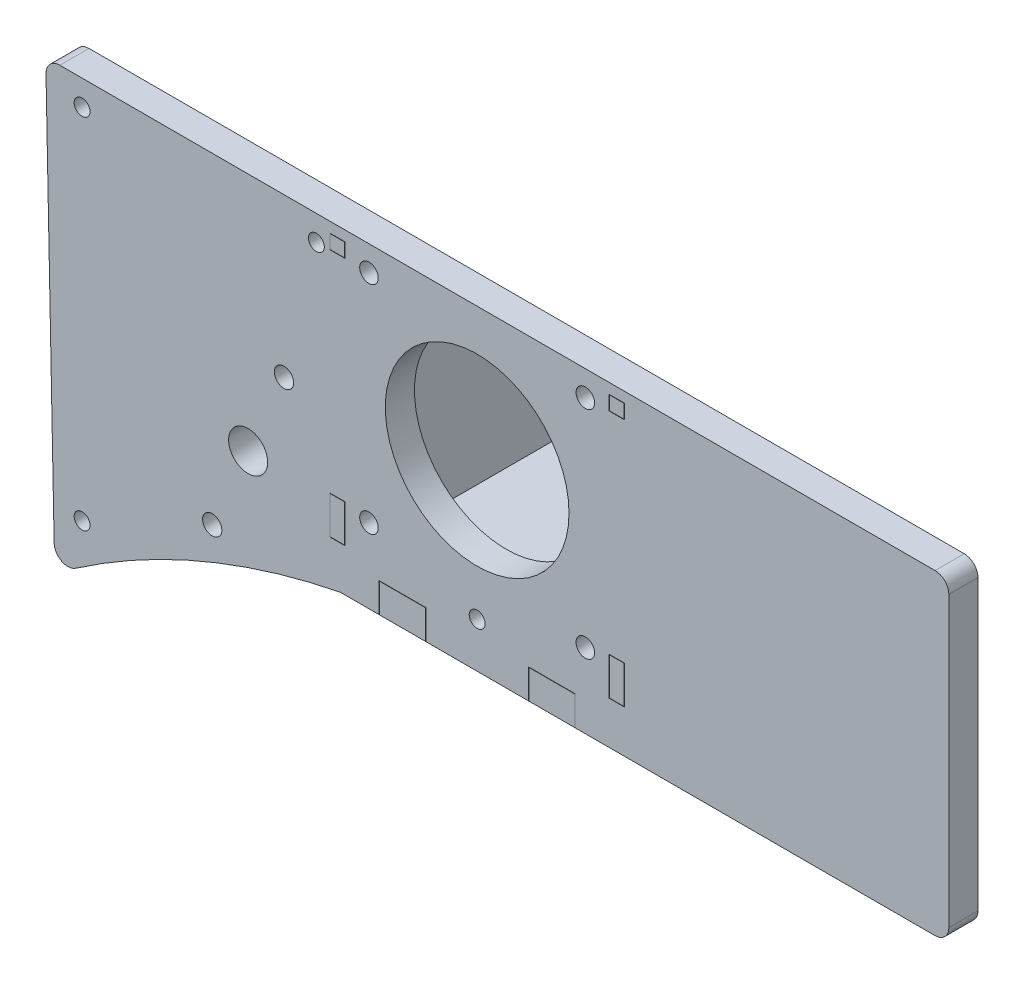
from build123d import *

# Parameters (mm, degrees)
SKETCH1_R              = 4.248828393
SKETCH1_R_2            = 6
SKETCH1_R_3            = 2.0195
EXTRUDE_10_32_DEPTH    = 6.35
SKETCH2_R              = 20
CUT_EXTRUDE1_DEPTH     = 6.35
SKETCH4_R              = 2.1
CUT_EXTRUDE_M5_DEPTH   = 6.35
FILLET2_R              = 3
SKETCH5_R              = 1.727
CUT_EXTRUDE_8_32_DEPTH = 10
BOSS_EXTRUDE1_DEPTH    = 6.35
SKETCH7_W              = 90
SKETCH7_H              = 6.35
BOSS_EXTRUDE2_DEPTH    = 56.175
CUT_EXTRUDE2_DEPTH     = 10
BOSS_EXTRUDE3_START    = 32
BOSS_EXTRUDE3_DEPTH    = 3.175
BOSS_EXTRUDE4_START    = -32
BOSS_EXTRUDE4_DEPTH    = 3.175
SKETCH12_W             = 10.027893718
SKETCH12_H             = 6.35
BOSS_EXTRUDE5_DEPTH    = 6.35
SKETCH13_W             = 3.315
SKETCH13_H             = 3.14
SKETCH13_H_2           = 8.293378994
SKETCH13_W_2           = 10.167893718
SKETCH13_H_3           = 6.49
CUT_EXTRUDE5_DEPTH     = 23.175
SKETCH15_W             = 3.315
SKETCH15_H             = 8.293378994
CUT_EXTRUDE6_DEPTH     = 95.175
FILLET3_R              = 3
FILLET4_R              = 6


with BuildPart() as part:
    # Sketch1 → 10-32 (new body)
    with BuildSketch(Plane.XY):
        with BuildLine():
            Line((-93.919580751, 29.026286008), (-91.967901368, -67.352834202))
            ThreePointArc((-91.967901368, -67.352834202), (-32.48927974, -40.356968754), (32.829000641, -40.430657228))
            Line((32.829000641, -40.430657228), (32.829000641, 26.026286008))
            ThreePointArc((32.829000641, 26.026286008), (31.950320985, 28.147606351), (29.829000641, 29.026286008))
            Line((29.829000641, 29.026286008), (-93.919580751, 29.026286008))
        make_face()
        with Locations((-49.861114932, -23.213556766)):
            Circle(SKETCH1_R, mode=Mode.SUBTRACT)
        Circle(SKETCH1_R_2, mode=Mode.SUBTRACT)
        with Locations((-23.55, 23.55)):
            Circle(SKETCH1_R_3, mode=Mode.SUBTRACT)
        with Locations((-23.55, -23.55)):
            Circle(SKETCH1_R_3, mode=Mode.SUBTRACT)
        with Locations((23.55, -23.55)):
            Circle(SKETCH1_R_3, mode=Mode.SUBTRACT)
        with Locations((23.55, 23.55)):
            Circle(SKETCH1_R_3, mode=Mode.SUBTRACT)
    extrude(amount=EXTRUDE_10_32_DEPTH)

    # Sketch2 → Cut-Extrude1 (cut)
    with BuildSketch(Plane.XY.offset(6.35)):
        Circle(SKETCH2_R)
    extrude(amount=-CUT_EXTRUDE1_DEPTH, mode=Mode.SUBTRACT)

    # Sketch4 → M5 (cut)
    with BuildSketch(Plane(origin=(0, 0, 0), x_dir=(-1, 0, 0), z_dir=(0, 0, -1))):
        with Locations((42.046855659, -5.405741086)):
            Circle(SKETCH4_R)
        with Locations((57.675374206, -41.021372445)):
            Circle(SKETCH4_R)
    extrude(amount=-CUT_EXTRUDE_M5_DEPTH, mode=Mode.SUBTRACT)

    # Fillet2
    fillet2_edges = [part.edges().sort_by_distance(p)[0] for p in [
        (-91.967901368, -67.352834202, 3.175),
        (-93.919580751, 29.026286008, 3.175),
        (32.829000641, -40.430657228, 3.175),
    ]]
    fillet(fillet2_edges, radius=FILLET2_R)

    # Sketch5 → 8-32 (cut)
    with BuildSketch(Plane.XY.offset(6.35)):
        with Locations((-86, 23.55)):
            Circle(SKETCH5_R)
        with Locations((-86, -54.45)):
            Circle(SKETCH5_R)
        with Locations((-35, 23.55)):
            Circle(SKETCH5_R)
        with Locations((0, -30)):
            Circle(SKETCH5_R)
    extrude(amount=-CUT_EXTRUDE_8_32_DEPTH, mode=Mode.SUBTRACT)

    # Sketch6 → Boss-Extrude1 (add)
    with BuildSketch(Plane(origin=(0, 0, 0), x_dir=(-1, 0, 0), z_dir=(0, 0, -1))):
        Polygon((33.987676393, -39.8), (33.987676393, -33.165841677), (-30.11229914, -33.165841677), (-29.829000641, 29.026286008), (-102.679000641, 29.026286008), (-102.679000641, -39.8), (-45, -39.8), align=None)
    extrude(amount=-BOSS_EXTRUDE1_DEPTH)

    # Sketch13 → Cut-Extrude5 (cut)
    with BuildSketch(Plane.XY):
        with Locations((-30.4125, 25.203378994)):
            Rectangle(SKETCH13_W, SKETCH13_H)
        with Locations((-30.4125, -26.373310503)):
            Rectangle(SKETCH13_W, SKETCH13_H_2)
        with Locations((30.4125, 25.203378994)):
            Rectangle(SKETCH13_W, SKETCH13_H)
        with Locations((30.4125, -26.373310503)):
            Rectangle(SKETCH13_W, SKETCH13_H_2)
        with Locations((-16.265787954, -36.625)):
            Rectangle(SKETCH13_W_2, SKETCH13_H_3)
        with Locations((16.265787954, -36.625)):
            Rectangle(SKETCH13_W_2, SKETCH13_H_3)
    extrude(amount=CUT_EXTRUDE5_DEPTH, mode=Mode.SUBTRACT)

    # Fillet3
    fillet3_edges = [part.edges().sort_by_distance(p)[0] for p in [
        (102.679000641, 29.026286008, 3.175),
        (102.679000641, -39.8, 3.175),
    ]]
    fillet(fillet3_edges, radius=FILLET3_R)


with BuildPart() as body_2:
    # Sketch7 → Boss-Extrude2 (new body)
    with BuildSketch(Plane(origin=(0, 0, 0), x_dir=(-1, 0, 0), z_dir=(0, 0, -1))):
        with Locations((0, -36.625)):
            Rectangle(SKETCH7_W, SKETCH7_H)
    extrude(amount=BOSS_EXTRUDE2_DEPTH)

    # Sketch8 → Cut-Extrude2 (cut)
    with BuildSketch(Plane(origin=(0, -33.45, 0), x_dir=(1, 0, 0), z_dir=(0, 1, 0))):
        with BuildLine():
            Line((-35.8, 48.77286316), (-35.8, 25.77286316))
            ThreePointArc((-35.8, 25.77286316), (-38, 23.57286316), (-40.2, 25.77286316))
            Line((-40.2, 25.77286316), (-40.2, 48.77286316))
            ThreePointArc((-40.2, 48.77286316), (-38, 50.97286316), (-35.8, 48.77286316))
        make_face()
        with BuildLine():
            Line((-45, 48.77286316), (-45, 25.77286316))
            ThreePointArc((-45, 25.77286316), (-39.870828693, 19.027494379), (-32, 22.167311885))
            Line((-32, 22.167311885), (-32, -16.424662842))
            Line((-32, -16.424662842), (-58.49448477, -16.424662842))
            Line((-58.49448477, -16.424662842), (-58.49448477, 89.110284315))
            Line((-58.49448477, 89.110284315), (0, 81.622667319))
            Line((0, 81.622667319), (58.49448477, 89.110284315))
            Line((58.49448477, 89.110284315), (58.49448477, -16.424662842))
            Line((58.49448477, -16.424662842), (32, -16.424662842))
            Line((32, -16.424662842), (32, 22.167311885))
            ThreePointArc((32, 22.167311885), (39.870828693, 19.027494379), (45, 25.77286316))
            Line((45, 25.77286316), (45, 48.77286316))
            ThreePointArc((45, 48.77286316), (39.870828693, 55.518231942), (32, 52.378414436))
            Line((32, 52.378414436), (-32, 52.378414436))
            ThreePointArc((-32, 52.378414436), (-39.870828693, 55.518231942), (-45, 48.77286316))
        make_face()
        with BuildLine():
            Line((35.8, 48.77286316), (35.8, 25.77286316))
            ThreePointArc((35.8, 25.77286316), (38, 23.57286316), (40.2, 25.77286316))
            Line((40.2, 25.77286316), (40.2, 48.77286316))
            ThreePointArc((40.2, 48.77286316), (38, 50.97286316), (35.8, 48.77286316))
        make_face()
    extrude(amount=-CUT_EXTRUDE2_DEPTH, mode=Mode.SUBTRACT)

    # Sketch12 → Boss-Extrude5 (add)
    with BuildSketch(Plane.XY):
        with Locations((-16.265787954, -36.625)):
            Rectangle(SKETCH12_W, SKETCH12_H)
        with Locations((16.265787954, -36.625)):
            Rectangle(SKETCH12_W, SKETCH12_H)
    extrude(amount=BOSS_EXTRUDE5_DEPTH)

    # Sketch15 → Cut-Extrude6 (cut)
    with BuildSketch(Plane(origin=(0, 0, 0), x_dir=(1, 0, 0), z_dir=(0, 1, 0))):
        with Locations((30.4125, 8.076689497)):
            Rectangle(SKETCH15_W, SKETCH15_H)
        with Locations((30.4125, 43.230068491)):
            Rectangle(SKETCH15_W, SKETCH15_H)
        with Locations((-30.4125, 43.230068491)):
            Rectangle(SKETCH15_W, SKETCH15_H)
        with Locations((-30.4125, 8.076689497)):
            Rectangle(SKETCH15_W, SKETCH15_H)
    extrude(amount=-CUT_EXTRUDE6_DEPTH, mode=Mode.SUBTRACT)

    # Fillet4
    fillet4_edges = [body_2.edges().sort_by_distance(p)[0] for p in [
        (32, -36.625, -52.378414436),
        (-32, -36.625, -52.378414436),
        (32, -36.625, -22.167311885),
        (-32, -36.625, -22.167311885),
    ]]
    fillet(fillet4_edges, radius=FILLET4_R)


with BuildPart() as body_3:
    # Sketch10 → Boss-Extrude3 (new body)
    with BuildSketch(Plane(origin=(0, 0, 0), x_dir=(0, 0, -1), z_dir=(1, 0, 0)).offset(BOSS_EXTRUDE3_START)):
        with BuildLine():
            Line((0, -33.45), (4, -33.45))
            Line((4, -33.45), (4, -39.8))
            Line((4, -39.8), (12.153378994, -39.8))
            Line((12.153378994, -39.8), (12.153378994, -33.45))
            Line((12.153378994, -33.45), (39.153378994, -33.45))
            Line((39.153378994, -33.45), (39.153378994, -39.8))
            Line((39.153378994, -39.8), (47.306757988, -39.8))
            Line((47.306757988, -39.8), (47.306757988, -33.45))
            Line((47.306757988, -33.45), (51.306757988, -33.45))
            ThreePointArc((51.306757988, -33.45), (51.759866787, -33.16140581), (51.689917319, -32.628769666))
            Line((51.689917319, -32.628769666), (0.883159331, 27.972865137))
            ThreePointArc((0.883159331, 27.972865137), (0.329090178, 28.121517589), (0, 27.651634803))
            Line((0, 27.651634803), (0, 26.703378994))
            Line((0, 26.703378994), (-6.35, 26.703378994))
            Line((-6.35, 26.703378994), (-6.35, 23.703378994))
            Line((-6.35, 23.703378994), (0, 23.703378994))
            Line((0, 23.703378994), (0, -22.296621006))
            Line((0, -22.296621006), (-6.35, -22.296621006))
            Line((-6.35, -22.296621006), (-6.35, -30.45))
            Line((-6.35, -30.45), (0, -30.45))
            Line((0, -30.45), (0, -33.45))
        make_face()
    extrude(amount=-BOSS_EXTRUDE3_DEPTH)


with BuildPart() as body_4:
    # Sketch10<2> → Boss-Extrude4 (new body)
    with BuildSketch(Plane(origin=(0, 0, 0), x_dir=(0, 0, -1), z_dir=(1, 0, 0)).offset(BOSS_EXTRUDE4_START)):
        with BuildLine():
            Line((0, -33.45), (4, -33.45))
            Line((4, -33.45), (4, -39.8))
            Line((4, -39.8), (12.153378994, -39.8))
            Line((12.153378994, -39.8), (12.153378994, -33.45))
            Line((12.153378994, -33.45), (39.153378994, -33.45))
            Line((39.153378994, -33.45), (39.153378994, -39.8))
            Line((39.153378994, -39.8), (47.306757988, -39.8))
            Line((47.306757988, -39.8), (47.306757988, -33.45))
            Line((47.306757988, -33.45), (51.306757988, -33.45))
            ThreePointArc((51.306757988, -33.45), (51.759866787, -33.16140581), (51.689917319, -32.628769666))
            Line((51.689917319, -32.628769666), (0.883159331, 27.972865137))
            ThreePointArc((0.883159331, 27.972865137), (0.329090178, 28.121517589), (0, 27.651634803))
            Line((0, 27.651634803), (0, 26.703378994))
            Line((0, 26.703378994), (-6.35, 26.703378994))
            Line((-6.35, 26.703378994), (-6.35, 23.703378994))
            Line((-6.35, 23.703378994), (0, 23.703378994))
            Line((0, 23.703378994), (0, -22.296621006))
            Line((0, -22.296621006), (-6.35, -22.296621006))
            Line((-6.35, -22.296621006), (-6.35, -30.45))
            Line((-6.35, -30.45), (0, -30.45))
            Line((0, -30.45), (0, -33.45))
        make_face()
    extrude(amount=BOSS_EXTRUDE4_DEPTH)


solid = Compound([part.part, body_2.part, body_3.part, body_4.part])
